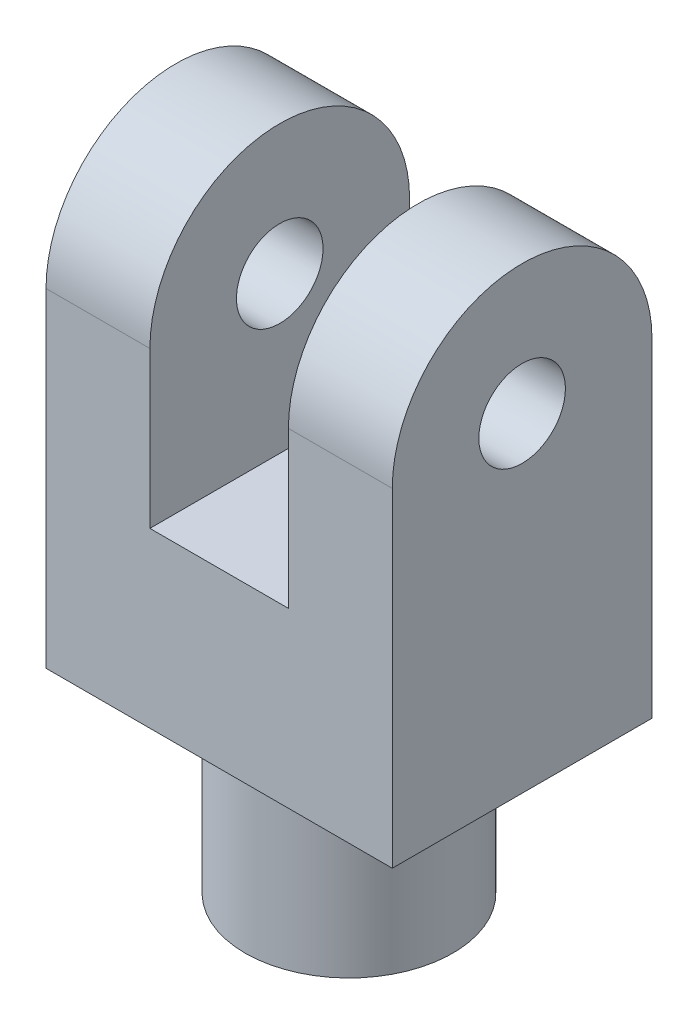
from build123d import *

# Parameters (mm, degrees)
EXTRUDE_1_DEPTH     = 40
SKETCH_2_R          = 12
EXTRUDE_2_DEPTH     = 20
SKETCH_3_W          = 16
SKETCH_3_H          = 43
CUT_EXTRUDE_1_DEPTH = 30
SKETCH_4_R          = 5
CUT_EXTRUDE_2_DEPTH = 85.581321815
SKETCH_5_R          = 6
CUT_EXTRUDE_3_DEPTH = 16


with BuildPart() as part:
    # 草图1 → 凸台-拉伸1 (new body)
    with BuildSketch(Plane(origin=(-20, 0, 0), x_dir=(0, 0, -1), z_dir=(1, 0, 0))):
        with BuildLine():
            Line((15, 20), (-15, 20))
            Line((-15, 20), (-15, 58))
            ThreePointArc((-15, 58), (0, 73), (15, 58))
            Line((15, 58), (15, 20))
        make_face()
    extrude(amount=EXTRUDE_1_DEPTH)

    # 草图2 → 凸台-拉伸2 (add)
    with BuildSketch(Plane(origin=(0, 0, 0), x_dir=(1, 0, 0), z_dir=(0, 1, 0))):
        with Locations(Location((0, 0, 0), (0, 0, 270))):
            Circle(SKETCH_2_R)
    extrude(amount=EXTRUDE_2_DEPTH)

    # 草图3 → 切除-拉伸1 (cut)
    with BuildSketch(Plane.XY.offset(-15)):
        with Locations((0, 61.5)):
            Rectangle(SKETCH_3_W, SKETCH_3_H)
    extrude(amount=CUT_EXTRUDE_1_DEPTH, mode=Mode.SUBTRACT)

    # 草图4 → 切除-拉伸2 (cut, through all)
    with BuildSketch(Plane(origin=(-20, 0, 0), x_dir=(0, 0, -1), z_dir=(1, 0, 0))):
        with Locations(Location((0, 58, 0), (0, 0, 180))):
            Circle(SKETCH_4_R)
    extrude(amount=CUT_EXTRUDE_2_DEPTH, mode=Mode.SUBTRACT)

    # 草图5 → 切除-拉伸3 (cut)
    with BuildSketch(Plane(origin=(0, 0, 0), x_dir=(1, 0, 0), z_dir=(0, 1, 0))):
        with Locations(Location((0, 0, 0), (0, 0, 270))):
            Circle(SKETCH_5_R)
    extrude(amount=CUT_EXTRUDE_3_DEPTH, mode=Mode.SUBTRACT)


solid = part.part
